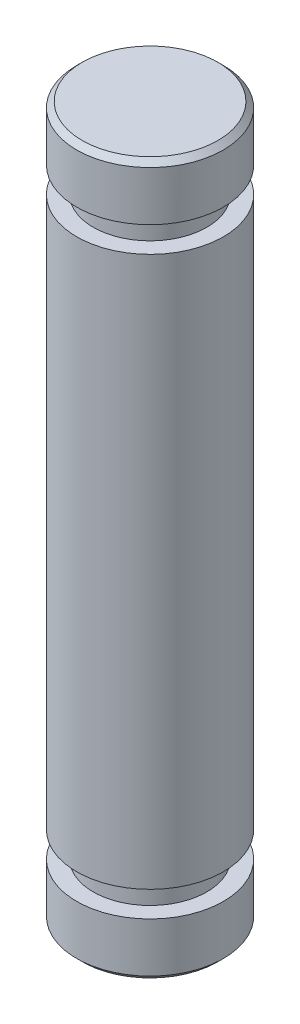
from build123d import *

# Parameters (mm, degrees)
CHAMFER1_SIZE = 0.15


with BuildPart() as part:
    # Sketch1 → Revolve1 (revolve)
    with BuildSketch(Plane.XY, mode=Mode.PRIVATE) as revolve1_sk:
        Polygon((0, 0), (0, 19.4), (2, 19.4), (2, 17.9), (1.55, 17.9), (1.55, 17.2), (2, 17.2), (2, 2.2), (1.55, 2.2), (1.55, 1.5), (2, 1.5), (2, 0), align=None)
    revolve(revolve1_sk.sketch.rotate(Axis((0, 0, 0), (0, 1, 0)), 90), axis=Axis((0, 0, 0), (0, 1, 0)))

    # Chamfer1
    chamfer1_edges = [part.edges().sort_by_distance(p)[0] for p in [
        (0, 19.4, 2),
        (0, 0, 2),
    ]]
    chamfer(chamfer1_edges, length=CHAMFER1_SIZE)


solid = part.part
